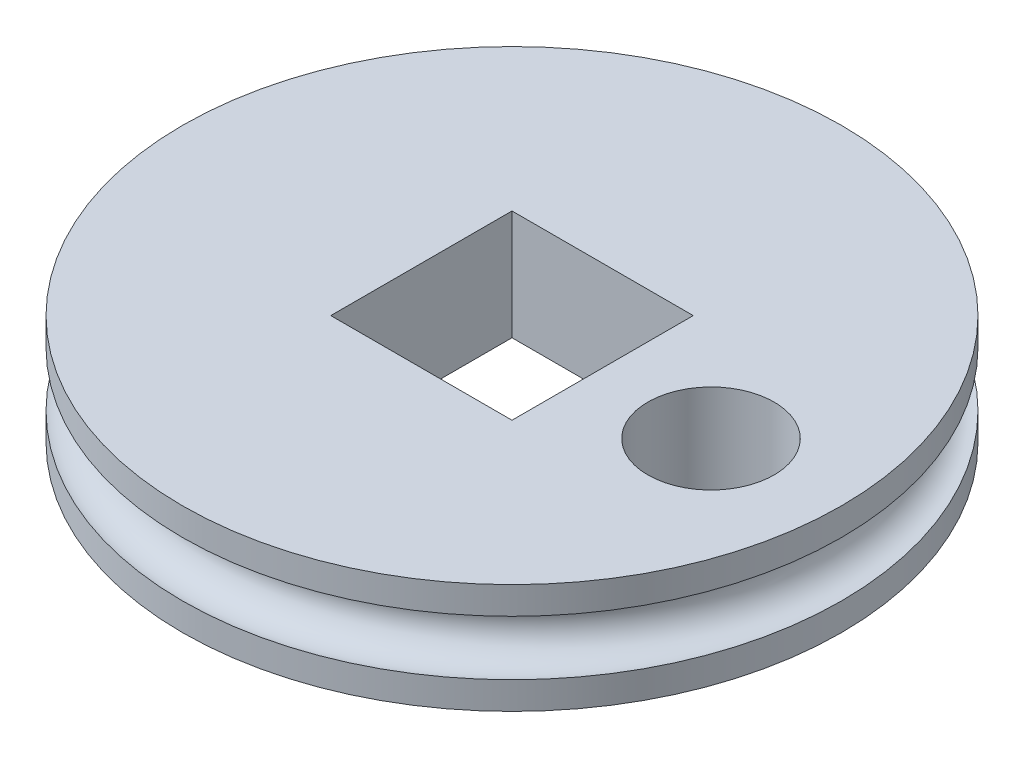
from build123d import *

# Parameters (mm, degrees)
SKIZZE1_R                       = 6
AUFSATZ_LINEAR_AUSTRAGEN1_DEPTH = 2
SKIZZE3_W                       = 3.3
SKIZZE3_H                       = 3.3
SCHNITT_LINEAR_AUSTRAGEN1_DEPTH = 3
SKIZZE4_R                       = 1.15
SCHNITT_LINEAR_AUSTRAGEN2_DEPTH = 3


with BuildPart() as part:
    # Skizze1 → Aufsatz-Linear austragen1 (new body)
    with BuildSketch(Plane(origin=(0, 0, 0), x_dir=(1, 0, 0), z_dir=(0, 1, 0))):
        with Locations(Location((0, 0, 0), (0, 0, 270))):
            Circle(SKIZZE1_R)
    extrude(amount=AUFSATZ_LINEAR_AUSTRAGEN1_DEPTH)

    # Skizze3 → Schnitt-Linear austragen1 (cut)
    with BuildSketch(Plane(origin=(0, 2, 0), x_dir=(1, 0, 0), z_dir=(0, 1, 0))):
        Rectangle(SKIZZE3_W, SKIZZE3_H)
    extrude(amount=-SCHNITT_LINEAR_AUSTRAGEN1_DEPTH, mode=Mode.SUBTRACT)

    # Skizze4 → Schnitt-Linear austragen2 (cut)
    with BuildSketch(Plane(origin=(0, 2, 0), x_dir=(1, 0, 0), z_dir=(0, 1, 0))):
        with Locations(Location((3.75, -0.126446108, 0), (0, 0, 270))):
            Circle(SKIZZE4_R)
    extrude(amount=-SCHNITT_LINEAR_AUSTRAGEN2_DEPTH, mode=Mode.SUBTRACT)

    # Skizze6 → Schnitt-Rotation2 (revolve, cut)
    with BuildSketch(Plane.XY, mode=Mode.PRIVATE) as schnitt_rotation2_sk:
        with BuildLine():
            Line((-6, 1.5), (-6, 0.5))
            ThreePointArc((-6, 0.5), (-5.384840005, 1), (-6, 1.5))
        make_face()
    revolve(schnitt_rotation2_sk.sketch.rotate(Axis((0, 2, 0), (0, -1, 0)), 270), axis=Axis((0, 2, 0), (0, -1, 0)), mode=Mode.SUBTRACT)


solid = part.part
